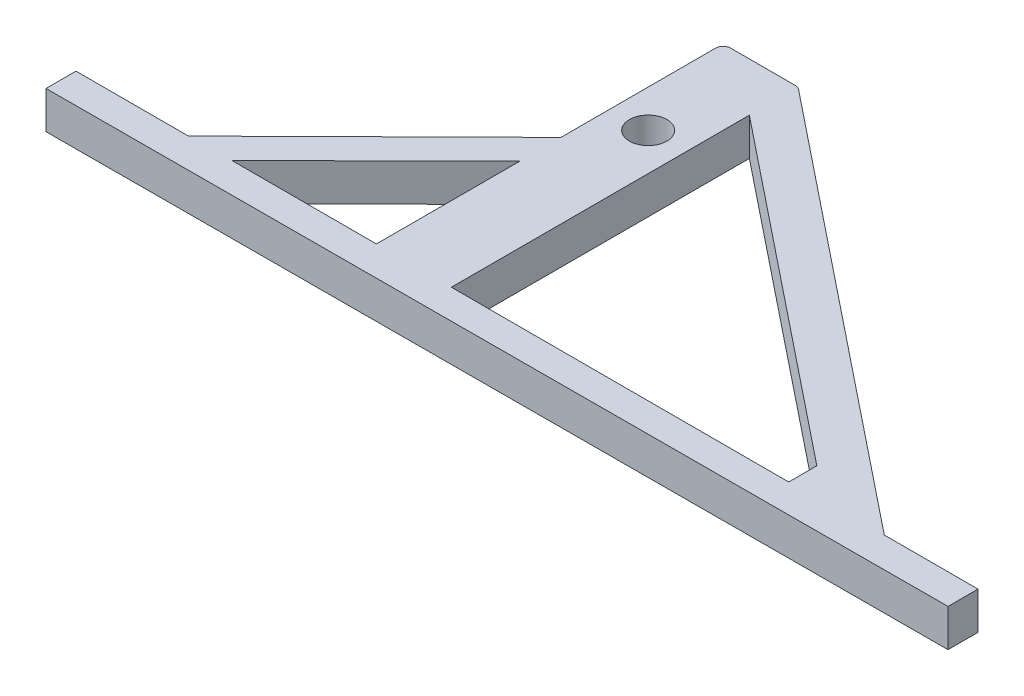
from build123d import *

# Parameters (mm, degrees)
SKETCH1_R           = 6.35
BOSS_EXTRUDE1_DEPTH = 12.7


with BuildPart() as part:
    # Sketch1 → Boss-Extrude1 (new body)
    with BuildSketch(Plane(origin=(0, 0, 0), x_dir=(1, 0, 0), z_dir=(0, 1, 0))):
        with BuildLine():
            Line((171.45, 10.16), (26.09574153, 126.443406776))
            ThreePointArc((26.09574153, 126.443406776), (25.34977374, 126.856815931), (24.509016109, 127))
            Line((24.509016109, 127), (2.54, 127))
            ThreePointArc((2.54, 127), (0.743948776, 126.256051224), (0, 124.46))
            Line((0, 124.46), (0, 72.055027479))
            Line((0, 72.055027479), (-63.5, 9.332908944))
            Line((-63.5, 9.332908944), (-101.6, 9.332908944))
            Line((-101.6, 9.332908944), (-101.6, -0.827091056))
            Line((-101.6, -0.827091056), (203.2, 0))
            Line((203.2, 0), (203.2, 10.16))
            Line((203.2, 10.16), (171.45, 10.16))
        make_face()
        with Locations(Location((12.7, 88.9, 0), (0, 0, 90))):
            Circle(SKETCH1_R, mode=Mode.SUBTRACT)
        Polygon((0, 9.525), (0, 58.085027479), (-48.962001116, 9.525), align=None, mode=Mode.SUBTRACT)
        Polygon((25.4, 9.525), (25.4, 110.49), (139.7, 19.05), (139.7, 9.525), align=None, mode=Mode.SUBTRACT)
    extrude(amount=BOSS_EXTRUDE1_DEPTH)


solid = part.part
